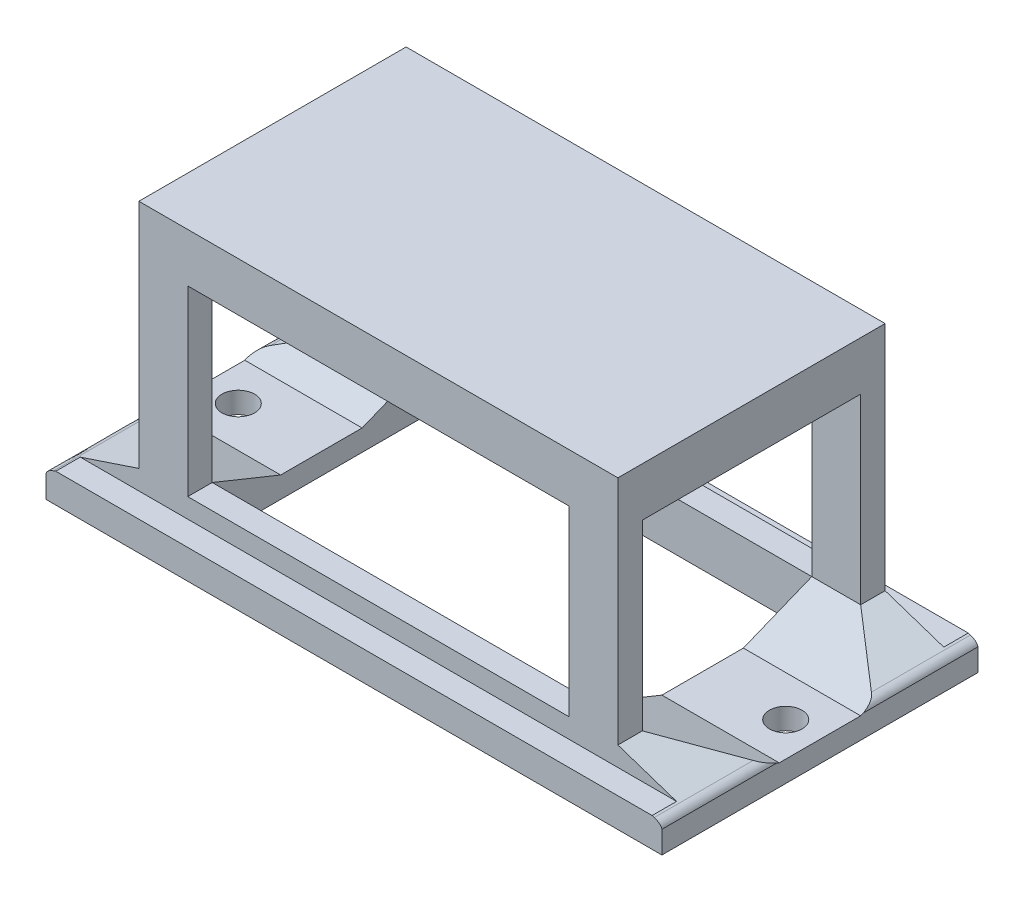
from build123d import *

# Parameters (mm, degrees)
SKETCH_1_W          = 29.4
SKETCH_1_H          = 19.4
SKETCH_1_W_2        = 23.4
SKETCH_1_H_2        = 13.4
EXTRUDE_1_DEPTH     = 16.4
SKETCH_2_W          = 29.4
SKETCH_2_H          = 19.4
EXTRUDE_2_DEPTH     = 0.8
SKETCH_7_W          = 13.4
SKETCH_7_H          = 5.6
CUT_EXTRUDE_2_DEPTH = 30
SKETCH_8_W          = 23.4
SKETCH_8_H          = 5.6
CUT_EXTRUDE_3_DEPTH = 30
SKETCH_9_W          = 19.4
SKETCH_9_H          = 3
EXTRUDE_5_DEPTH     = 4.2
CUT_EXTRUDE_4_DEPTH = 20.2
CUT_EXTRUDE_5_DEPTH = 5.1
SKETCH_12_R         = 1
CUT_EXTRUDE_6_DEPTH = 2.2
CUT_EXTRUDE_7_DEPTH = 15.4


with BuildPart() as part:
    # 草图1 → 凸台-拉伸1 (new body)
    with BuildSketch(Plane(origin=(0, 0, 0), x_dir=(1, 0, 0), z_dir=(0, 1, 0))):
        Rectangle(SKETCH_1_W, SKETCH_1_H)
        Rectangle(SKETCH_1_W_2, SKETCH_1_H_2, mode=Mode.SUBTRACT)
    extrude(amount=EXTRUDE_1_DEPTH)

    # 草图2 → 凸台-拉伸2 (add)
    with BuildSketch(Plane(origin=(0, 16.4, 0), x_dir=(1, 0, 0), z_dir=(0, 1, 0))):
        Rectangle(SKETCH_2_W, SKETCH_2_H)
    extrude(amount=EXTRUDE_2_DEPTH)

    # 草图7 → 切除-拉伸2 (cut)
    with BuildSketch(Plane.ZY.offset(14.7)):
        with Locations((0, 11.4)):
            Rectangle(SKETCH_7_W, SKETCH_7_H)
        with Locations((0, 5.8)):
            Rectangle(SKETCH_7_W, SKETCH_7_H)
    extrude(amount=-CUT_EXTRUDE_2_DEPTH, mode=Mode.SUBTRACT)

    # 草图8 → 切除-拉伸3 (cut)
    with BuildSketch(Plane(origin=(0, 0, -9.7), x_dir=(-1, 0, 0), z_dir=(0, 0, -1))):
        with Locations((0, 11.4)):
            Rectangle(SKETCH_8_W, SKETCH_8_H)
        with Locations((0, 5.8)):
            Rectangle(SKETCH_8_W, SKETCH_8_H)
    extrude(amount=-CUT_EXTRUDE_3_DEPTH, mode=Mode.SUBTRACT)

    # 草图9 → 凸台-拉伸5 (add)
    with BuildSketch(Plane(origin=(14.7, 0, 0), x_dir=(0, 0, -1), z_dir=(1, 0, 0))):
        with Locations((0, 1.5)):
            Rectangle(SKETCH_9_W, SKETCH_9_H)
    extrude_5 = extrude(amount=EXTRUDE_5_DEPTH)

    # 草图10 → 切除-拉伸4 (cut)
    with BuildSketch(Plane.XY.offset(9.7)):
        with BuildLine():
            add(Edge.make_bspline(
                [(18.486644801, 1.737785066), (18.825886074, 1.616028978), (18.9, 1.36920832)],
                knots=[0.049557912, 0.049557912, 0.049557912, 0.659174515, 0.659174515, 0.659174515], degree=2))
            Line((18.9, 1.36920832), (18.9, 1.6))
            Line((18.9, 1.6), (18.9, 3))
            Line((18.9, 3), (14.7, 3))
            Line((14.7, 3), (18.429736397, 1.756754534))
            add(Edge.make_bspline(
                [(18.429736397, 1.756754534), (18.459066665, 1.747683054), (18.486644801, 1.737785066)],
                knots=[0, 0, 0, 0.049557912, 0.049557912, 0.049557912], degree=2))
        make_face()
    cut_extrude_4 = extrude(amount=-CUT_EXTRUDE_4_DEPTH, mode=Mode.SUBTRACT)

    # 草图11 → 切除-拉伸5 (cut, symmetric)
    with BuildSketch(Plane(origin=(14.7, 0, 0), x_dir=(0, 0, -1), z_dir=(1, 0, 0))):
        Polygon((2.5, 1.3), (6.7, 3), (-6.7, 3), (-2.5, 1.3), align=None)
    cut_extrude_5 = extrude(amount=CUT_EXTRUDE_5_DEPTH, both=True, mode=Mode.SUBTRACT)

    # 草图12 → 切除-拉伸6 (cut)
    with BuildSketch(Plane(origin=(0, 1.3, 0), x_dir=(1, 0, 0), z_dir=(0, 1, 0))):
        with Locations(Location((16.8, 0, 0), (0, 0, 270))):
            Circle(SKETCH_12_R)
    cut_extrude_6 = extrude(amount=-CUT_EXTRUDE_6_DEPTH, mode=Mode.SUBTRACT)

    # 镜向1: 凸台-拉伸5, 切除-拉伸4, 切除-拉伸5, 切除-拉伸6 across plane
    add(extrude_5.mirror(Plane(origin=(0, 0, 0), x_dir=(0, 0, 1), z_dir=(1, 0, 0))))
    add(cut_extrude_4.mirror(Plane(origin=(0, 0, 0), x_dir=(0, 0, 1), z_dir=(1, 0, 0))), mode=Mode.SUBTRACT)
    add(cut_extrude_5.mirror(Plane(origin=(0, 0, 0), x_dir=(0, 0, 1), z_dir=(1, 0, 0))), mode=Mode.SUBTRACT)
    add(cut_extrude_6.mirror(Plane(origin=(0, 0, 0), x_dir=(0, 0, 1), z_dir=(1, 0, 0))), mode=Mode.SUBTRACT)

    # 草图13 → 切除-拉伸7 (cut)
    with BuildSketch(Plane(origin=(0, 17.2, 0), x_dir=(1, 0, 0), z_dir=(0, 1, 0))):
        Polygon((-14.7, 9.7), (14.7, 9.7), (18.9, 9.7), (18.9, 8.2), (14.7, 8.2), (-14.7, 8.2), (-18.9, 8.2), (-18.9, 9.7), align=None)
        Polygon((14.7, -9.7), (-14.7, -9.7), (-18.9, -9.7), (-18.9, -8.2), (-14.7, -8.2), (14.7, -8.2), (18.9, -8.2), (18.9, -9.7), align=None)
    extrude(amount=-CUT_EXTRUDE_7_DEPTH, mode=Mode.SUBTRACT)


solid = part.part
